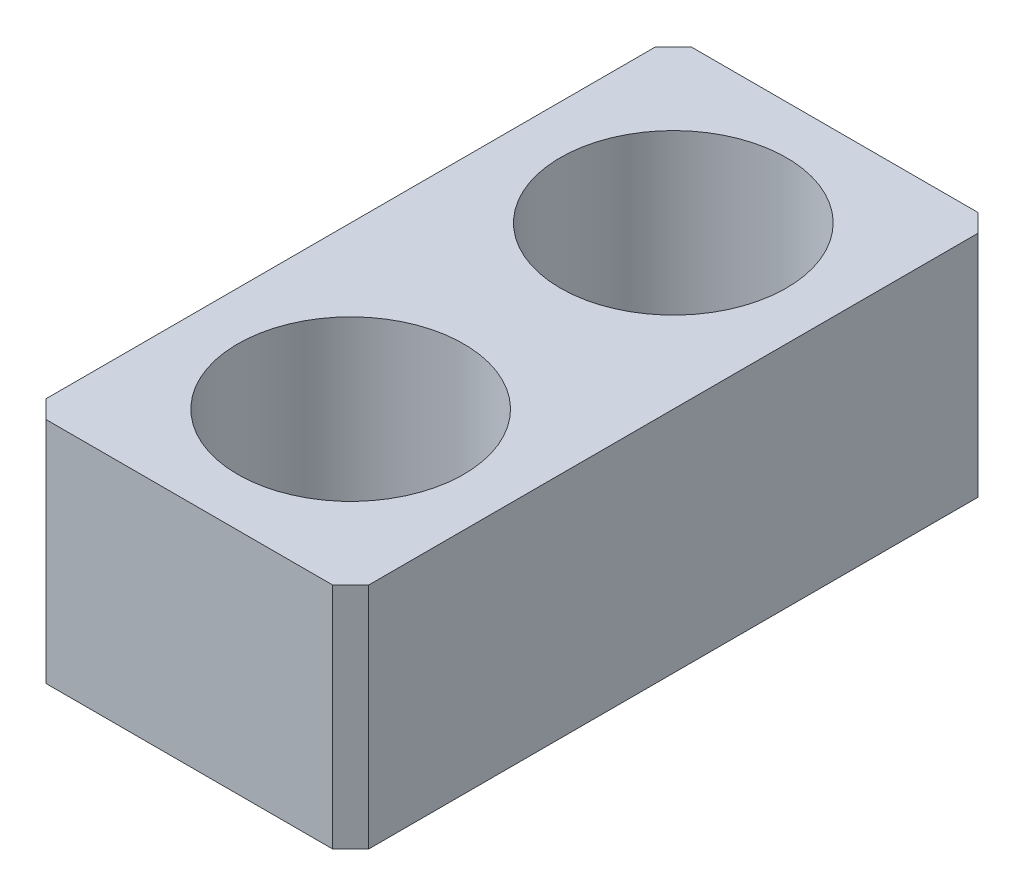
from build123d import *

# Parameters (mm, degrees)
EXTRUDE_1_DEPTH     = 1.8
SKETCH_2_R          = 0.89
CUT_EXTRUDE_1_DEPTH = 4.362216531


with BuildPart() as part:
    # Эскиз1 → Бобышка-Вытянуть1 (new body)
    with BuildSketch(Plane(origin=(0, 0, 0), x_dir=(1, 0, 0), z_dir=(0, 1, 0))):
        Polygon((-1.128578644, 2.54), (1.128578644, 2.54), (1.27, 2.398578644), (1.27, -2.398578644), (1.128578644, -2.54), (-1.128578644, -2.54), (-1.27, -2.398578644), (-1.27, 2.398578644), align=None)
    extrude(amount=EXTRUDE_1_DEPTH)

    # Эскиз2 → Вырез-Вытянуть1 (cut, through all)
    with BuildSketch(Plane(origin=(0, 1.8, 0), x_dir=(1, 0, 0), z_dir=(0, 1, 0))):
        with Locations(Location((0, 1.27, 0), (0, 0, 270))):
            Circle(SKETCH_2_R)
        with Locations(Location((0, -1.27, 0), (0, 0, 270))):
            Circle(SKETCH_2_R)
    extrude(amount=-CUT_EXTRUDE_1_DEPTH, mode=Mode.SUBTRACT)


solid = part.part
